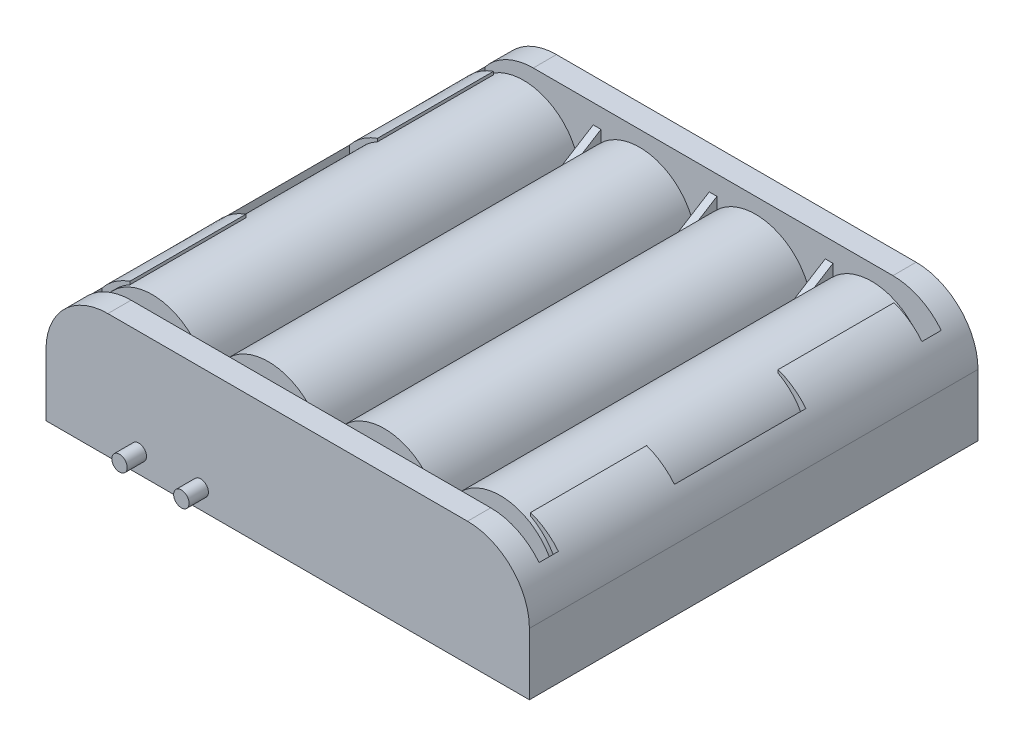
from build123d import *

# Parameters (mm, degrees)
SKETCH1_W           = 62.5
SKETCH1_H           = 58
BOSS_EXTRUDE1_DEPTH = 16
FILLET1_R           = 8
SKETCH2_W           = 14
SKETCH2_H           = 52
CUT_EXTRUDE1_DEPTH  = 14
CUT_EXTRUDE2_REACH  = 59.294
SKETCH4_R           = 7.25
BOSS_EXTRUDE3_DEPTH = 24
SKETCH6_R           = 1
BOSS_EXTRUDE5_DEPTH = 2.5


with BuildPart() as part:
    # Sketch1 → Boss-Extrude1 (new body)
    with BuildSketch(Plane(origin=(0, 0, 0), x_dir=(1, 0, 0), z_dir=(0, 1, 0))):
        Rectangle(SKETCH1_W, SKETCH1_H)
    extrude(amount=BOSS_EXTRUDE1_DEPTH)

    # Fillet1
    fillet1_edges = [part.edges().sort_by_distance(p)[0] for p in [
        (-31.25, 16, 0),
        (31.25, 16, 0),
    ]]
    fillet(fillet1_edges, radius=FILLET1_R)

    # Sketch2 → Cut-Extrude1 (cut)
    with BuildSketch(Plane(origin=(0, 16, 0), x_dir=(1, 0, 0), z_dir=(0, 1, 0))):
        Polygon((-29.5, 26), (-15.5, 26), (-15.5, -26), (-29.5, -26), (-29.5, -23.5), (-25.9, -23.5), (-25.9, -8.5), (-29.5, -8.5), (-29.5, 8.5), (-25.9, 8.5), (-25.9, 23.5), (-29.5, 23.5), align=None)
        with Locations((-7.5, 0)):
            Rectangle(SKETCH2_W, SKETCH2_H)
        Polygon((15.5, 26), (29.5, 26), (29.5, 23.5), (25.9, 23.5), (25.9, 8.5), (29.5, 8.5), (29.5, -8.5), (25.9, -8.5), (25.9, -23.5), (29.5, -23.5), (29.5, -26), (15.5, -26), align=None)
        with Locations((7.5, 0)):
            Rectangle(SKETCH2_W, SKETCH2_H)
    extrude(amount=-CUT_EXTRUDE1_DEPTH, mode=Mode.SUBTRACT)

    # Cut-Extrude2: up to this face of the body (flat: up to its plane)
    cut_extrude2_end = Plane(part.part.faces().sort_by_distance((-15.5, 9, 0))[0])
    # Sketch3 → Cut-Extrude2 (cut, up to the picked face)
    with BuildSketch(Plane(origin=(15.5, 0, 0), x_dir=(0, 0, -1), z_dir=(1, 0, 0)), mode=Mode.PRIVATE) as cut_extrude2_sk1:
        Polygon((-26, 16), (-26, 13.5), (-17.5, 8.2), (17.5, 8.2), (26, 13.5), (26, 16), align=None)
    cut_extrude2_tool1 = split(extrude(cut_extrude2_sk1.sketch, amount=-CUT_EXTRUDE2_REACH, mode=Mode.PRIVATE), bisect_by=cut_extrude2_end, keep=Keep.BOTH, mode=Mode.PRIVATE)
    add(cut_extrude2_tool1.solids().sort_by(Axis((15.5, 12.366556, 0), (-1, 0, 0)))[0], mode=Mode.SUBTRACT)

    # Sketch4 → Boss-Extrude3 (add, symmetric)
    with BuildSketch(Plane.XY):
        with Locations((-22.5, 8.75)):
            Circle(SKETCH4_R)
        with Locations((-7.5, 8.75)):
            Circle(SKETCH4_R)
        with Locations((22.5, 8.75)):
            Circle(SKETCH4_R)
        with Locations((7.5, 8.75)):
            Circle(SKETCH4_R)
    extrude(amount=BOSS_EXTRUDE3_DEPTH, both=True)

    # Sketch6 → Boss-Extrude5 (add)
    with BuildSketch(Plane.XY.offset(29)):
        with Locations(Location((-19.25, 2.5, 0), (0, 0, 180))):
            Circle(SKETCH6_R)
        with Locations(Location((-11.25, 2.5, 0), (0, 0, 180))):
            Circle(SKETCH6_R)
    extrude(amount=BOSS_EXTRUDE5_DEPTH)


solid = part.part
